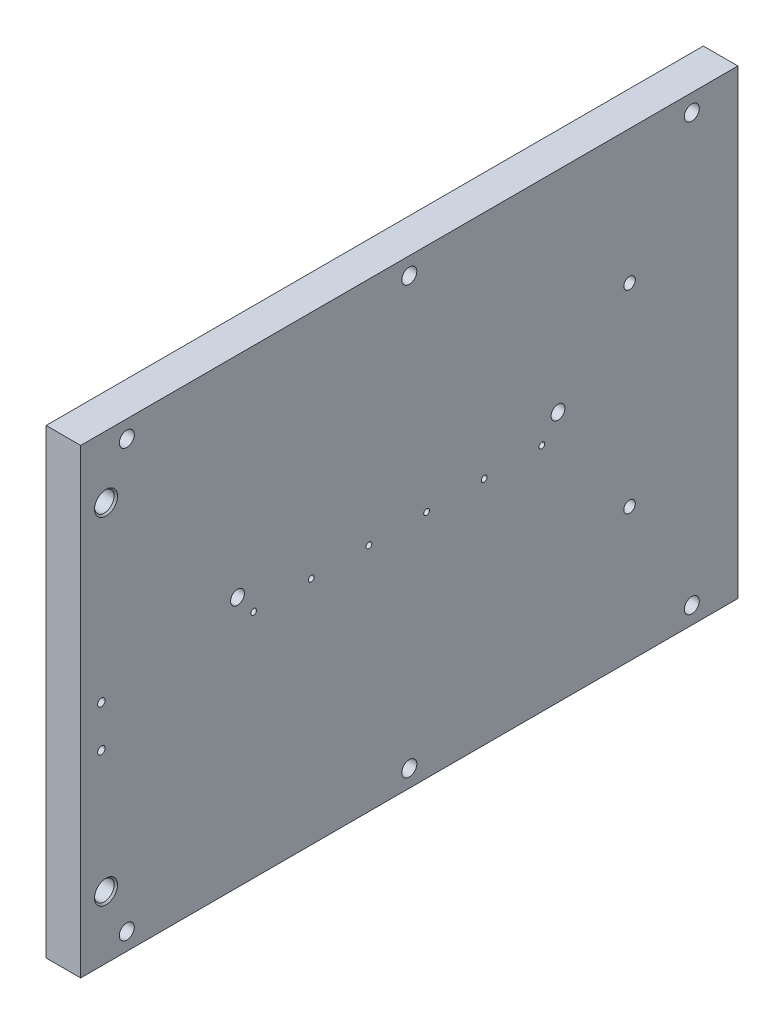
from build123d import *

# Parameters (mm, degrees)
SKETCH1_W                    = 285
SKETCH1_H                    = 200
BOSS_EXTRUDE1_DEPTH          = 15
SKETCH4_R                    = 3
CUT_EXTRUDE1_DEPTH           = 7
M6_TAPPED_HOLE1_D            = 5
M6_TAPPED_HOLE1_DEPTH        = 10
M6_TAPPED_HOLE1_TIP          = 1.502151548
LPATTERN1_COUNT              = 6
LPATTERN1_PITCH              = 25
M6_TAPPED_HOLE2_D            = 5
M6_TAPPED_HOLE2_DEPTH        = 10
M6_TAPPED_HOLE2_TIP          = 1.502151548
M4_TAPPED_HOLE1_D            = 3.3
M4_TAPPED_HOLE1_DEPTH        = 10.1
M4_TAPPED_HOLE1_TIP          = 0.991420021
M10_TAPPED_HOLE1_D           = 8.5
M10_TAPPED_HOLE1_CSINK_D     = 10
M10_TAPPED_HOLE1_CSINK_ANGLE = 90
F_6_5_6_5_DIAMETER_HOLE1_D   = 6.5


with BuildPart() as part:
    # Sketch1 → Boss-Extrude1 (new body)
    with BuildSketch(Plane(origin=(0, 0, 0), x_dir=(0, 0, -1), z_dir=(1, 0, 0))):
        with Locations((-142.5, 100)):
            Rectangle(SKETCH1_W, SKETCH1_H)
    extrude(amount=-BOSS_EXTRUDE1_DEPTH)

    # Sketch4 → Cut-Extrude1 (cut)
    with BuildSketch(Plane(origin=(0, 0, 0), x_dir=(0, 0, -1), z_dir=(1, 0, 0))):
        with Locations((-217, 109)):
            Circle(SKETCH4_R)
        with Locations((-78, 109)):
            Circle(SKETCH4_R)
    extrude(amount=-CUT_EXTRUDE1_DEPTH, mode=Mode.SUBTRACT)

    # M6 Tapped Hole1
    with Locations(Plane(origin=(0, 0, 0), x_dir=(-1, 0, 0), z_dir=(0, 0, -1))):
        with Locations((7.5, 25), (7.5, 100), (7.5, 175)):
            Hole(M6_TAPPED_HOLE1_D / 2, depth=M6_TAPPED_HOLE1_DEPTH)
            with Locations((0, 0, -(M6_TAPPED_HOLE1_DEPTH + M6_TAPPED_HOLE1_TIP / 2))):  # 118° drill point
                Cone(0, M6_TAPPED_HOLE1_D / 2, M6_TAPPED_HOLE1_TIP, mode=Mode.SUBTRACT)

    # Sketch5 → M3 Tapped Hole1 (revolve, cut)
    with BuildSketch(Plane(origin=(0, 100, 85), x_dir=(0, 0, -1), z_dir=(0, 1, 0))):
        Polygon((0, 0), (0, 8.251075774), (1.25, 7.5), (1.25, 0), align=None)
    m3_tapped_hole1 = revolve(axis=Axis((6.35, 100, 85), (-1, 0, 0)), mode=Mode.SUBTRACT)

    # LPattern1: M3 Tapped Hole1 ×6
    with Locations(*[(0, 0, i * LPATTERN1_PITCH) for i in range(1, LPATTERN1_COUNT)]):
        add(m3_tapped_hole1, mode=Mode.SUBTRACT)

    # M6 Tapped Hole2
    with Locations(Plane(origin=(0, 0, 0), x_dir=(0, 0, -1), z_dir=(1, 0, 0))):
        with Locations((-47, 58), (-47, 142)):
            Hole(M6_TAPPED_HOLE2_D / 2, depth=M6_TAPPED_HOLE2_DEPTH)
            with Locations((0, 0, -(M6_TAPPED_HOLE2_DEPTH + M6_TAPPED_HOLE2_TIP / 2))):  # 118° drill point
                Cone(0, M6_TAPPED_HOLE2_D / 2, M6_TAPPED_HOLE2_TIP, mode=Mode.SUBTRACT)

    # M4 Tapped Hole1
    with Locations(Plane(origin=(0, 0, 0), x_dir=(0, 0, -1), z_dir=(1, 0, 0))):
        with Locations((-276, 81), (-276, 99)):
            Hole(M4_TAPPED_HOLE1_D / 2, depth=M4_TAPPED_HOLE1_DEPTH)
            with Locations((0, 0, -(M4_TAPPED_HOLE1_DEPTH + M4_TAPPED_HOLE1_TIP / 2))):  # 118° drill point
                Cone(0, M4_TAPPED_HOLE1_D / 2, M4_TAPPED_HOLE1_TIP, mode=Mode.SUBTRACT)

    # M10 Tapped Hole1 (through all)
    with Locations(Plane(origin=(0, 0, 0), x_dir=(0, 0, -1), z_dir=(1, 0, 0))):
        with Locations((-274, 27), (-274, 173)):
            CounterSinkHole(M10_TAPPED_HOLE1_D / 2, M10_TAPPED_HOLE1_CSINK_D / 2, counter_sink_angle=M10_TAPPED_HOLE1_CSINK_ANGLE)

    # Ø6.5 (6.5) Diameter Hole1 (through all)
    with Locations(Plane(origin=(0, 0, 0), x_dir=(0, 0, -1), z_dir=(1, 0, 0))):
        with Locations((-265, 7.5), (-142.5, 7.5), (-20, 7.5), (-20, 192.5), (-142.5, 192.5), (-265, 192.5)):
            Hole(F_6_5_6_5_DIAMETER_HOLE1_D / 2)


solid = part.part
